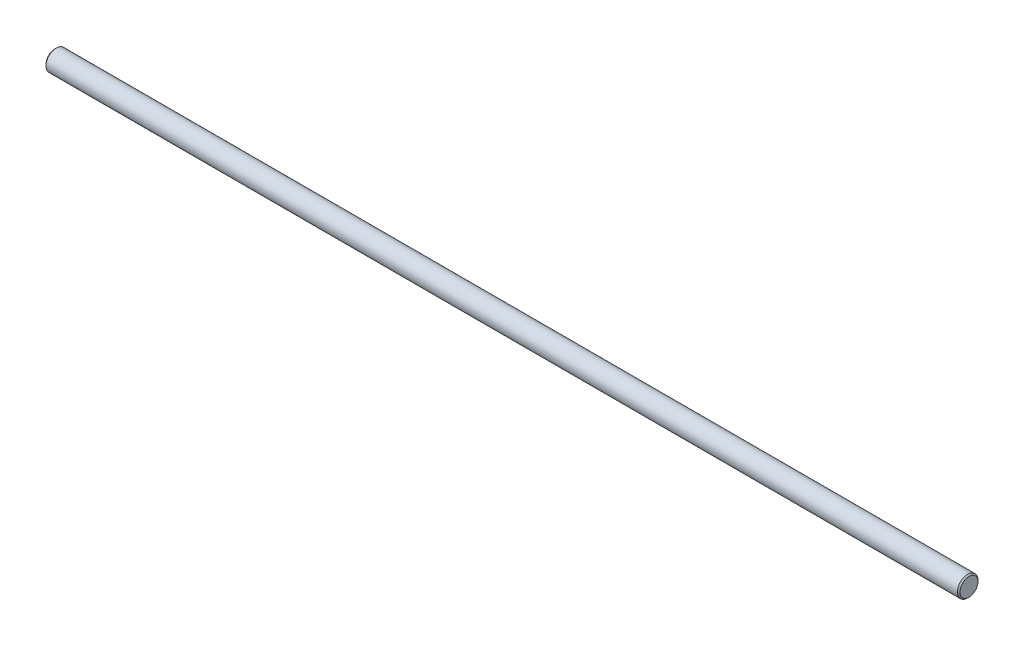
from build123d import *


with BuildPart() as part:
    # Sketch1 → Revolve1 (revolve)
    with BuildSketch(Plane.XY, mode=Mode.PRIVATE) as revolve1_sk:
        Polygon((0, 3.5), (0, 0), (355, 0), (355, 3.5), (354.5, 4), (0.5, 4), align=None)
    revolve(revolve1_sk.sketch.rotate(Axis((0, 0, 0), (1, 0, 0)), 270), axis=Axis((0, 0, 0), (1, 0, 0)))


solid = part.part
